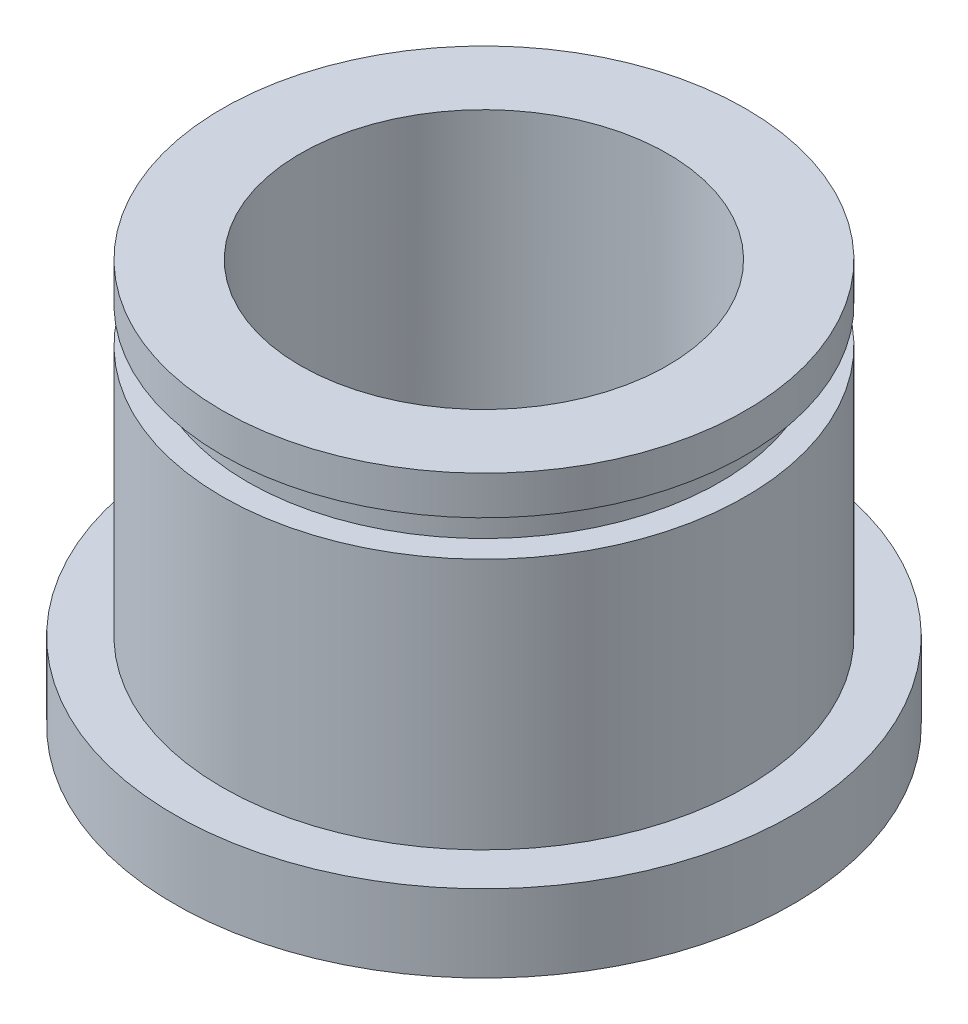
from build123d import *

# Parameters (mm, degrees)
F_19_64_0_29688_DIAMETER_HOLE1_D     = 7.540752
F_19_64_0_29688_DIAMETER_HOLE1_DEPTH = 8.382
F_19_64_0_29688_DIAMETER_HOLE1_TIP   = 2.265470457
CHAMFER1_SIZE                        = 0.79375


with BuildPart() as part:
    # Sketch1 → Revolve1 (revolve)
    with BuildSketch(Plane(origin=(0, 0, 0), x_dir=(0, 0, -1), z_dir=(1, 0, 0)), mode=Mode.PRIVATE) as revolve1_sk:
        Polygon((0, -4.143375), (-6.35, -4.143375), (-6.35, -2.555875), (-5.3721, -2.555875), (-5.3721, 2.613025), (-4.8514, 2.613025), (-4.8514, 3.349625), (-5.3721, 3.349625), (-5.3721, 4.143375), (0, 4.143375), align=None)
    revolve(revolve1_sk.sketch.rotate(Axis((0, 0, 0), (0, 1, 0)), 180), axis=Axis((0, 0, 0), (0, 1, 0)))

    # 19/64 (0.29688) Diameter Hole1
    with Locations(Plane(origin=(0, 4.143375, 0), x_dir=(1, 0, 0), z_dir=(0, 1, 0))):
        with Locations((0, 0)):
            Hole(F_19_64_0_29688_DIAMETER_HOLE1_D / 2, depth=F_19_64_0_29688_DIAMETER_HOLE1_DEPTH)
            with Locations((0, 0, -(F_19_64_0_29688_DIAMETER_HOLE1_DEPTH + F_19_64_0_29688_DIAMETER_HOLE1_TIP / 2))):  # 118° drill point
                Cone(0, F_19_64_0_29688_DIAMETER_HOLE1_D / 2, F_19_64_0_29688_DIAMETER_HOLE1_TIP, mode=Mode.SUBTRACT)

    # Chamfer1
    chamfer1_edges = [part.edges().sort_by_distance(p)[0] for p in [
        (3.770376, -4.143375, 0),
    ]]
    chamfer(chamfer1_edges, length=CHAMFER1_SIZE)


solid = part.part
